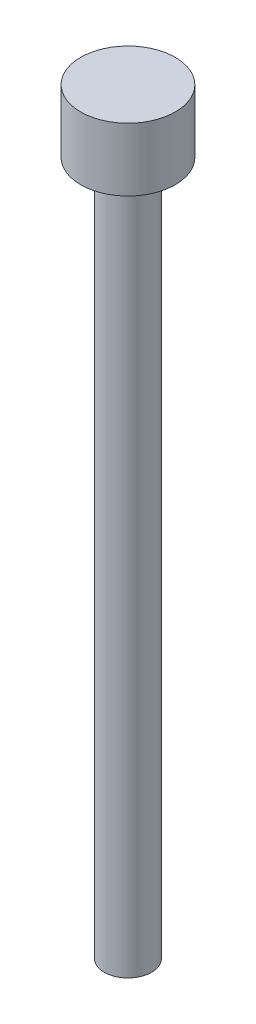
from build123d import *

# Parameters (mm, degrees)
SKETCH1_R           = 4.7625
BOSS_EXTRUDE1_DEPTH = 6.35
SKETCH2_R           = 2.38125
BOSS_EXTRUDE2_DEPTH = 69.85


with BuildPart() as part:
    # Sketch1 → Boss-Extrude1 (new body)
    with BuildSketch(Plane(origin=(0, 0, 0), x_dir=(1, 0, 0), z_dir=(0, 1, 0))):
        with Locations(Location((0, 0, 0), (0, 0, 270))):
            Circle(SKETCH1_R)
    extrude(amount=BOSS_EXTRUDE1_DEPTH)

    # Sketch2 → Boss-Extrude2 (add)
    with BuildSketch(Plane(origin=(0, 0, 0), x_dir=(-1, 0, 0), z_dir=(0, -1, 0))):
        with Locations(Location((0, 0, 0), (0, 0, 90))):
            Circle(SKETCH2_R)
    extrude(amount=BOSS_EXTRUDE2_DEPTH)


solid = part.part
